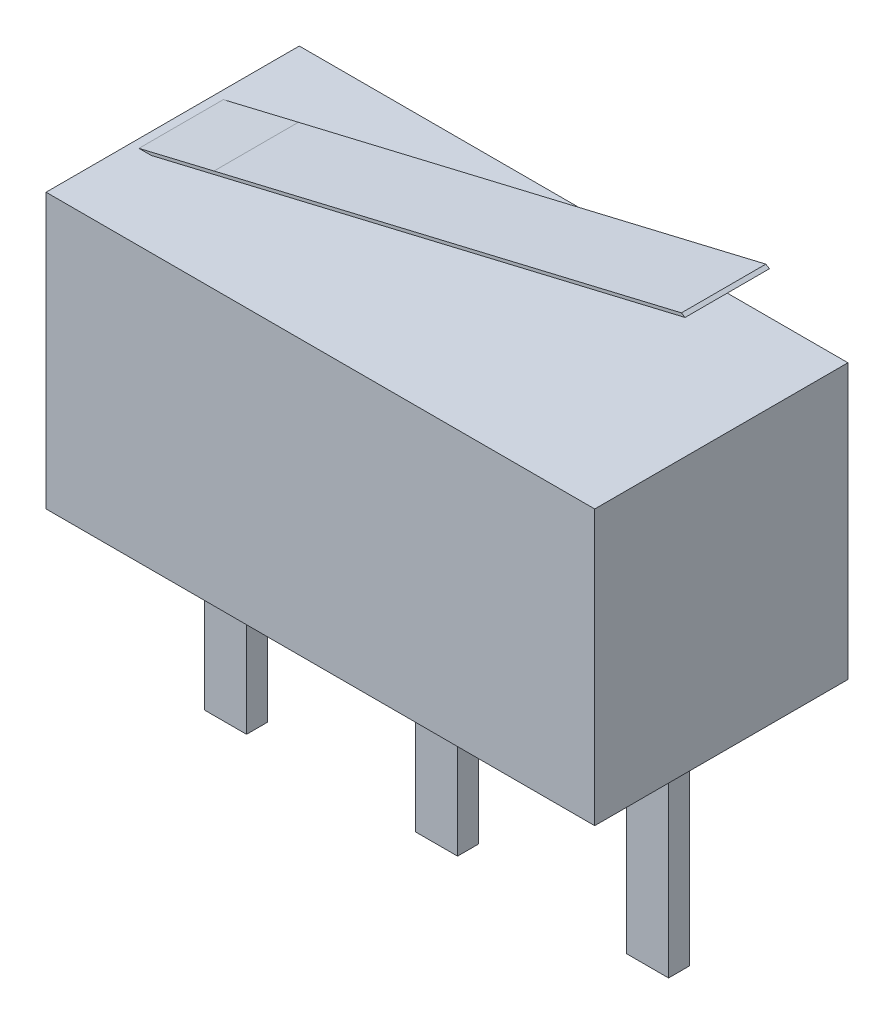
from build123d import *

# Parameters (mm, degrees)
ESQUISSE1_W        = 13
ESQUISSE1_H        = 6
BOSS_EXTRU_1_DEPTH = 6.5
ESQUISSE2_W        = 1
ESQUISSE2_H        = 0.5
BOSS_EXTRU_2_DEPTH = 5
BOSS_EXTRU_3_DEPTH = 1


with BuildPart() as part:
    # Esquisse1 → Boss.-Extru.1 (new body)
    with BuildSketch(Plane(origin=(0, 0, 0), x_dir=(1, 0, 0), z_dir=(0, 1, 0))):
        Rectangle(ESQUISSE1_W, ESQUISSE1_H)
    extrude(amount=BOSS_EXTRU_1_DEPTH)

    # Esquisse2 → Boss.-Extru.2 (add)
    with BuildSketch(Plane.XZ):
        with Locations((-5, 0)):
            Rectangle(ESQUISSE2_W, ESQUISSE2_H)
        Rectangle(ESQUISSE2_W, ESQUISSE2_H)
        with Locations((5, 0)):
            Rectangle(ESQUISSE2_W, ESQUISSE2_H)
    extrude(amount=BOSS_EXTRU_2_DEPTH)

    # Esquisse3 → Boss.-Extru.3 (add, symmetric)
    with BuildSketch(Plane.XY):
        Polygon((-6.00813505, 6.5), (6.640975591, 9.5), (6.555428051, 9.551784345), (-4.520695815, 6.924850916), (-6.3, 6.5), align=None)
    extrude(amount=BOSS_EXTRU_3_DEPTH, both=True)


solid = part.part
